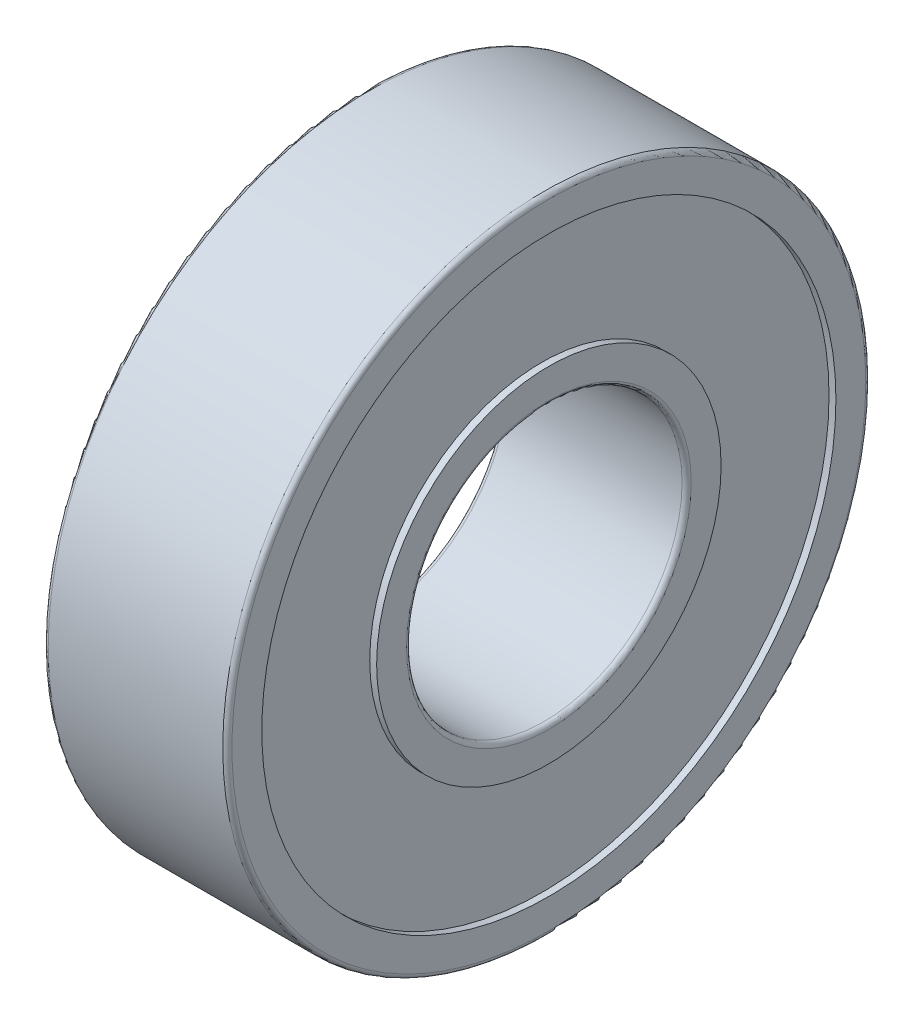
from build123d import *

# Parameters (mm, degrees)
FILLET1_R = 0.2


with BuildPart() as part:
    # Sketch1 → Revolve1 (revolve)
    with BuildSketch(Plane.XY, mode=Mode.PRIVATE) as revolve1_sk:
        Polygon((4, 6), (-4, 6), (-4, 7.5), (-3.7, 7.5), (-3.7, 12.5), (-4, 12.5), (-4, 14), (4, 14), (4, 12.5), (3.7, 12.5), (3.7, 7.5), (4, 7.5), align=None)
    revolve(revolve1_sk.sketch.rotate(Axis((0, 0, 0), (-1, 0, 0)), 90), axis=Axis((0, 0, 0), (-1, 0, 0)))

    # Fillet1
    fillet1_edges = [part.edges().sort_by_distance(p)[0] for p in [
        (4, 0, 14),
        (-4, 0, 14),
        (-4, 0, 6),
        (4, 0, 6),
    ]]
    fillet(fillet1_edges, radius=FILLET1_R)


solid = part.part
